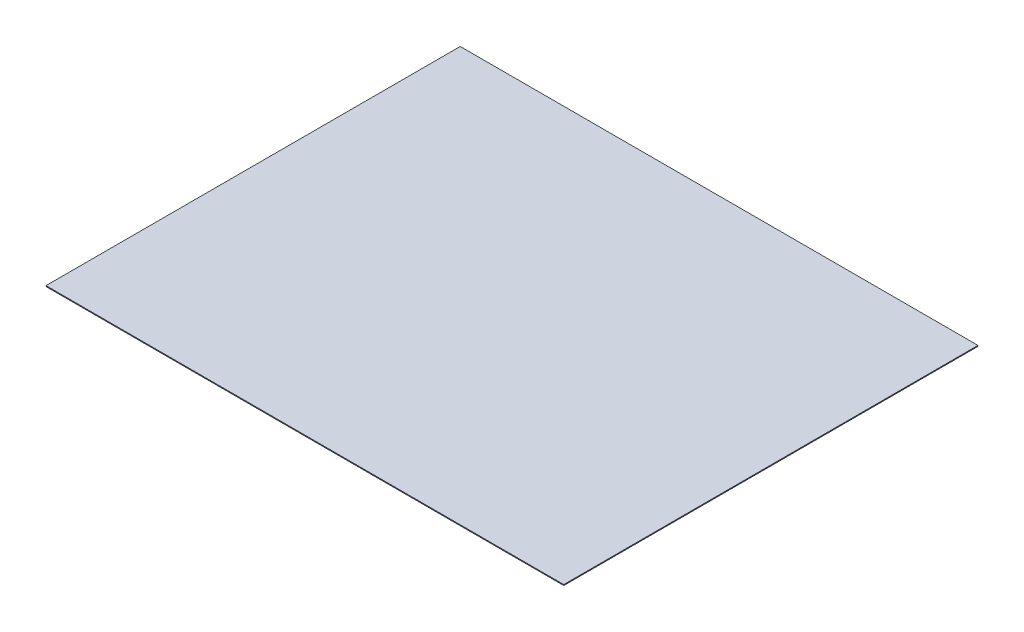
from build123d import *

# Parameters (mm, degrees)
SKETCH1_W           = 1524
SKETCH1_H           = 1219.2
BOSS_EXTRUDE1_DEPTH = 2.54


with BuildPart() as part:
    # Sketch1 → Boss-Extrude1 (new body)
    with BuildSketch(Plane(origin=(0, 0, 0), x_dir=(1, 0, 0), z_dir=(0, 1, 0))):
        Rectangle(SKETCH1_W, SKETCH1_H)
    extrude(amount=BOSS_EXTRUDE1_DEPTH)


solid = part.part
